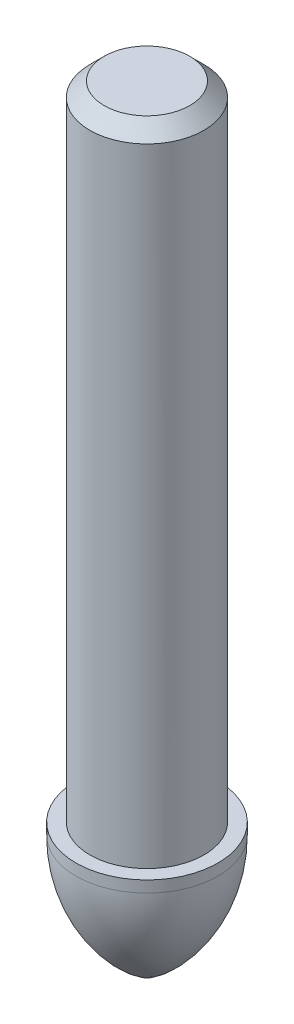
from build123d import *

# Parameters (mm, degrees)
CHAMFER1_SIZE = 1


with BuildPart() as part:
    # Sketch1 → Revolve1 (revolve)
    with BuildSketch(Plane.XY, mode=Mode.PRIVATE) as revolve1_sk:
        with BuildLine():
            Line((0, 0), (4, 0))
            Line((4, 0), (4, -45))
            Line((4, -45), (4.976, -45))
            Line((4.976, -45), (4.976, -45.8))
            ThreePointArc((4.976, -45.8), (3.846610973, -50.40476271), (0.714778212, -53.9643951))
            ThreePointArc((0.714778212, -53.9643951), (0.374606751, -54.13147105), (0, -54.188923448))
            Line((0, -54.188923448), (0, 0))
        make_face()
    revolve(revolve1_sk.sketch.rotate(Axis((0, 0, 0), (0, -1, 0)), 180), axis=Axis((0, 0, 0), (0, -1, 0)))

    # Chamfer1
    chamfer1_edges = [part.edges().sort_by_distance(p)[0] for p in [
        (4, 0, 0),
    ]]
    chamfer(chamfer1_edges, length=CHAMFER1_SIZE)


solid = part.part
